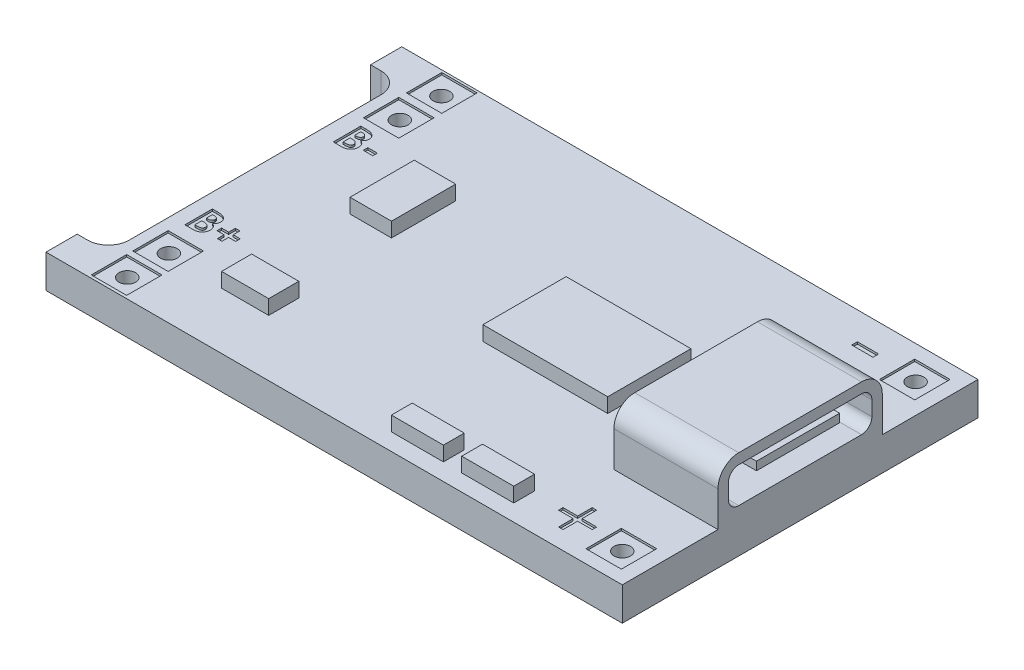
from build123d import *

# Parameters (mm, degrees)
SKETCH1_R           = 0.4
BOSS_EXTRUDE1_DEPTH = 1.6
SKETCH2_W           = 1.7
SKETCH2_H           = 1.7
CUT_EXTRUDE1_DEPTH  = 0.1
CUT_EXTRUDE2_START  = -1.6
SKETCH2_2_W         = 1.7
SKETCH2_2_H         = 1.7
CUT_EXTRUDE2_DEPTH  = 0.1
SKETCH3_W           = 1.993109399
SKETCH3_H           = 3.08736554
SKETCH3_W_2         = 2.266673434
SKETCH3_H_2         = 1.445981329
SKETCH3_W_3         = 2.5
SKETCH3_H_3         = 1
SKETCH3_W_4         = 6
SKETCH3_H_4         = 4
SKETCH3_W_5         = 5
SKETCH3_H_5         = 7.9
BOSS_EXTRUDE2_DEPTH = 0.7
SKETCH3_2_W         = 5
SKETCH3_2_H         = 7.9
BOSS_EXTRUDE3_DEPTH = 2.7
FILLET1_R           = 1
SKETCH4_W           = 4
SKETCH4_H           = 0.4
CUT_EXTRUDE3_DEPTH  = 4
SKETCH7_W           = 0.457932693
SKETCH7_H           = 0.220486111
CUT_EXTRUDE4_DEPTH  = 0.1
SKETCH6_W           = 1.017628206
SKETCH6_H           = 0.271367521
CUT_EXTRUDE5_DEPTH  = 0.1
CUT_EXTRUDE6_DEPTH  = 0.1


with BuildPart() as part:
    # Sketch1 → Boss-Extrude1 (new body)
    with BuildSketch(Plane(origin=(0, 0, 0), x_dir=(1, 0, 0), z_dir=(0, 1, 0))):
        with BuildLine():
            Line((0, 0), (27.7, 0))
            Line((27.7, 0), (27.7, 17.1))
            Line((27.7, 17.1), (0, 17.1))
            Line((0, 17.1), (0, 15.6))
            Line((0, 15.6), (0.5, 15.6))
            ThreePointArc((0.5, 15.6), (1.207106781, 15.307106781), (1.5, 14.6))
            Line((1.5, 14.6), (1.5, 2.5))
            ThreePointArc((1.5, 2.5), (1.207106781, 1.792893219), (0.5, 1.5))
            Line((0.5, 1.5), (0, 1.5))
            Line((0, 1.5), (0, 0))
        make_face()
        with Locations(Location((2.907438593, 16.1, 0), (0, 0, 270))):
            Circle(SKETCH1_R, mode=Mode.SUBTRACT)
        with Locations(Location((2.907438593, 14.1, 0), (0, 0, 270))):
            Circle(SKETCH1_R, mode=Mode.SUBTRACT)
        with Locations(Location((2.907438593, 3, 0), (0, 0, 270))):
            Circle(SKETCH1_R, mode=Mode.SUBTRACT)
        with Locations(Location((2.907438593, 1, 0), (0, 0, 270))):
            Circle(SKETCH1_R, mode=Mode.SUBTRACT)
        with Locations(Location((26.2, 15.6, 0), (0, 0, 270))):
            Circle(SKETCH1_R, mode=Mode.SUBTRACT)
        with Locations(Location((26.2, 1.5, 0), (0, 0, 270))):
            Circle(SKETCH1_R, mode=Mode.SUBTRACT)
    extrude(amount=BOSS_EXTRUDE1_DEPTH)

    # Sketch2 → Cut-Extrude1 (cut)
    with BuildSketch(Plane(origin=(0, 1.6, 0), x_dir=(1, 0, 0), z_dir=(0, 1, 0))):
        with Locations((2.885159762, 16.138735787)):
            Rectangle(SKETCH2_W, SKETCH2_H)
        with Locations((2.885159762, 14.071021036)):
            Rectangle(SKETCH2_W, SKETCH2_H)
        with Locations((2.888957816, 2.981417951)):
            Rectangle(SKETCH2_W, SKETCH2_H)
        with Locations((2.888957816, 0.988098465)):
            Rectangle(SKETCH2_W, SKETCH2_H)
        with Locations((26.182003828, 15.576133366)):
            Rectangle(SKETCH2_W, SKETCH2_H)
        with Locations((26.175693586, 1.480002018)):
            Rectangle(SKETCH2_W, SKETCH2_H)
    extrude(amount=-CUT_EXTRUDE1_DEPTH, mode=Mode.SUBTRACT)

    # Sketch2<2> → Cut-Extrude2 (cut)
    with BuildSketch(Plane(origin=(0, 1.6, 0), x_dir=(1, 0, 0), z_dir=(0, 1, 0)).offset(CUT_EXTRUDE2_START)):
        with Locations((2.885159762, 16.138735787)):
            Rectangle(SKETCH2_2_W, SKETCH2_2_H)
        with Locations((2.885159762, 14.071021036)):
            Rectangle(SKETCH2_2_W, SKETCH2_2_H)
        with Locations((2.888957816, 2.981417951)):
            Rectangle(SKETCH2_2_W, SKETCH2_2_H)
        with Locations((2.888957816, 0.988098465)):
            Rectangle(SKETCH2_2_W, SKETCH2_2_H)
        with Locations((26.182003828, 15.576133366)):
            Rectangle(SKETCH2_2_W, SKETCH2_2_H)
        with Locations((26.175693586, 1.480002018)):
            Rectangle(SKETCH2_2_W, SKETCH2_2_H)
    extrude(amount=CUT_EXTRUDE2_DEPTH, mode=Mode.SUBTRACT)

    # Sketch3 → Boss-Extrude2 (add)
    with BuildSketch(Plane(origin=(0, 1.6, 0), x_dir=(1, 0, 0), z_dir=(0, 1, 0))):
        with Locations((6.717794797, 10.435637814)):
            Rectangle(SKETCH3_W, SKETCH3_H)
        with Locations((6.854576815, 3.440214628)):
            Rectangle(SKETCH3_W_2, SKETCH3_H_2)
        with Locations((17.034488534, 1.318370706)):
            Rectangle(SKETCH3_W_3, SKETCH3_H_3)
        with Locations((20.435077133, 1.298830418)):
            Rectangle(SKETCH3_W_3, SKETCH3_H_3)
        with Locations((17.220133962, 8.781603915)):
            Rectangle(SKETCH3_W_4, SKETCH3_H_4)
        with Locations((25.2, 8.55)):
            Rectangle(SKETCH3_W_5, SKETCH3_H_5)
    extrude(amount=BOSS_EXTRUDE2_DEPTH)

    # Sketch3<2> → Boss-Extrude3 (add)
    with BuildSketch(Plane(origin=(0, 1.6, 0), x_dir=(1, 0, 0), z_dir=(0, 1, 0))):
        with Locations((25.2, 8.55)):
            Rectangle(SKETCH3_2_W, SKETCH3_2_H)
    extrude(amount=BOSS_EXTRUDE3_DEPTH)

    # Fillet1
    fillet1_edges = [part.edges().sort_by_distance(p)[0] for p in [
        (25.2, 4.3, -4.6),
        (25.2, 4.3, -12.5),
    ]]
    fillet(fillet1_edges, radius=FILLET1_R)

    # Sketch4 → Cut-Extrude3 (cut)
    with BuildSketch(Plane(origin=(27.7, 0, 0), x_dir=(0, 0, -1), z_dir=(1, 0, 0))):
        with BuildLine():
            Line((5.1, 3.3), (5.1, 2.6))
            ThreePointArc((5.1, 2.6), (5.246446609, 2.246446609), (5.6, 2.1))
            Line((5.6, 2.1), (11.5, 2.1))
            ThreePointArc((11.5, 2.1), (11.853553391, 2.246446609), (12, 2.6))
            Line((12, 2.6), (12, 3.3))
            ThreePointArc((12, 3.3), (11.853553391, 3.653553391), (11.5, 3.8))
            Line((11.5, 3.8), (5.6, 3.8))
            ThreePointArc((5.6, 3.8), (5.246446609, 3.653553391), (5.1, 3.3))
        make_face()
        with Locations((8.451076766, 3.321053565)):
            Rectangle(SKETCH4_W, SKETCH4_H, mode=Mode.SUBTRACT)
    extrude(amount=-CUT_EXTRUDE3_DEPTH, mode=Mode.SUBTRACT)

    # Sketch7 → Cut-Extrude4 (cut)
    # profile 1 of 4: a face of its own
    with BuildSketch(Plane(origin=(0, 1.6, 0), x_dir=(1, 0, 0), z_dir=(0, 1, 0))):
        with BuildLine():
            Line((2.200310142, 4.475849905), (2.200310142, 5.798766571))
            Line((2.200310142, 5.798766571), (2.412316018, 5.798766571))
            add(Edge.make_bspline(
                [(2.412316018, 5.798766571), (2.427157755, 5.798768265), (2.455876234, 5.798771543), (2.497309505, 5.797316542), (2.535735365, 5.795434336), (2.571031528, 5.793328585), (2.60325807, 5.789699956), (2.632365985, 5.785875776), (2.658413432, 5.781264052), (2.674517153, 5.777127192), (2.682093495, 5.775180918)],
                knots=[0, 0, 0, 0, 1.311965854, 2.538629056, 3.664479157, 4.713267157, 5.663616078, 6.530575999, 7.308677837, 8, 8, 8, 8], degree=3))
            add(Edge.make_bspline(
                [(2.682093495, 5.775180918), (2.692042002, 5.772435662), (2.711564165, 5.767048591), (2.739526134, 5.756169166), (2.766051961, 5.744075914), (2.79110926, 5.730279776), (2.81454417, 5.714614193), (2.836267628, 5.696954838), (2.856748158, 5.678010558), (2.875258541, 5.65725338), (2.891988877, 5.635319576), (2.90652454, 5.612214894), (2.919154168, 5.588292619), (2.929261178, 5.563251706), (2.936876621, 5.537207475), (2.942446524, 5.510271137), (2.946056575, 5.482357462), (2.946397677, 5.463366876), (2.946570825, 5.453727008)],
                knots=[0, 0, 0, 0, 1.099996261, 2.158545794, 3.195537121, 4.207578794, 5.205712374, 6.197378256, 7.190519799, 8.17788031, 9.159561366, 10.129234751, 11.085776129, 12.040971148, 13.00380137, 13.975669004, 14.972423361, 16, 16, 16, 16], degree=3))
            add(Edge.make_bspline(
                [(2.946570825, 5.453727008), (2.946118095, 5.441342309), (2.94522695, 5.416964549), (2.939534256, 5.381158032), (2.928859569, 5.347315726), (2.914892001, 5.314813931), (2.895900475, 5.283773879), (2.871784909, 5.254210328), (2.842935898, 5.225212973), (2.820807114, 5.207831015), (2.809297021, 5.198789942)],
                knots=[0, 0, 0, 0, 0.986156485, 1.941127874, 2.875419072, 3.804401753, 4.751181392, 5.761612777, 6.835722519, 8, 8, 8, 8], degree=3))
            add(Edge.make_bspline(
                [(2.809297021, 5.198789942), (2.818624248, 5.194028473), (2.83691236, 5.184692551), (2.862876106, 5.169347081), (2.886915701, 5.153025228), (2.909138931, 5.136055393), (2.929079638, 5.117718201), (2.947561207, 5.099070266), (2.963671855, 5.079043139), (2.978078481, 5.058350625), (2.990600486, 5.036693094), (3.001505772, 5.01410712), (3.010717076, 4.990515546), (3.018517446, 4.966038432), (3.024334965, 4.940591589), (3.02812811, 4.914165916), (3.03103238, 4.886851539), (3.031258304, 4.868245667), (3.031373176, 4.858785518)],
                knots=[0, 0, 0, 0, 1.164658916, 2.283573913, 3.35186032, 4.395461096, 5.390182219, 6.362969632, 7.312859996, 8.245001507, 9.165155236, 10.092416118, 11.032087915, 11.979892451, 12.947605196, 13.931445124, 14.948243989, 16, 16, 16, 16], degree=3))
            add(Edge.make_bspline(
                [(3.031373176, 4.858785518), (3.030627737, 4.840717175), (3.029156617, 4.805059371), (3.018400503, 4.752705525), (2.999752818, 4.703069331), (2.974712824, 4.656348064), (2.943858733, 4.613894228), (2.908385376, 4.576705036), (2.868649889, 4.54522521), (2.8319891, 4.523978771), (2.800280404, 4.509720422), (2.774016684, 4.500905013), (2.745810005, 4.49273843), (2.715143689, 4.487003687), (2.682573674, 4.48175462), (2.647782401, 4.478513737), (2.610834893, 4.476317471), (2.585457748, 4.476008911), (2.572380454, 4.475849905)],
                knots=[0, 0, 0, 0, 1.284142165, 2.534249414, 3.780121997, 5.041676246, 6.291546858, 7.49970053, 8.684500223, 9.883330709, 10.50184324, 11.153274765, 11.851151195, 12.587658647, 13.369265475, 14.195992086, 15.070362669, 16, 16, 16, 16], degree=3))
            Line((2.572380454, 4.475849905), (2.200310142, 4.475849905))
        make_face()
        with BuildLine():
            Line((2.437756723, 5.56131999), (2.437756723, 5.272991999))
            Line((2.437756723, 5.272991999), (2.500828471, 5.272991999))
            add(Edge.make_bspline(
                [(2.500828471, 5.272991999), (2.509400488, 5.27306675), (2.525948249, 5.273211053), (2.549849733, 5.275069622), (2.572074254, 5.278240456), (2.592537519, 5.282664568), (2.611430149, 5.288282544), (2.628631454, 5.29504218), (2.644065802, 5.30328967), (2.661996945, 5.315574671), (2.680951456, 5.3336526), (2.697636899, 5.359769913), (2.707464513, 5.389804724), (2.708559044, 5.410987599), (2.709124244, 5.421926127)],
                knots=[0, 0, 0, 0, 1.065314748, 2.056525647, 2.977365736, 3.853934255, 4.656397591, 5.425096493, 6.14721249, 6.826394842, 8.123232004, 9.372140726, 10.643011755, 12, 12, 12, 12], degree=3))
            add(Edge.make_bspline(
                [(2.709124244, 5.421926127), (2.708671981, 5.432171875), (2.707797548, 5.451981619), (2.697902403, 5.479796263), (2.682533288, 5.50444573), (2.664387888, 5.521316274), (2.647300467, 5.532838358), (2.632669169, 5.54042516), (2.61661022, 5.547216788), (2.598812738, 5.552409832), (2.579378354, 5.556306509), (2.558401473, 5.559168152), (2.535845903, 5.561115908), (2.520266723, 5.561250504), (2.512223787, 5.56131999)],
                knots=[0, 0, 0, 0, 1.347982417, 2.606269829, 3.849316587, 5.153353503, 5.842674298, 6.568177932, 7.326619318, 8.142485038, 9.012069166, 9.942760135, 10.937925643, 12, 12, 12, 12], degree=3))
            Line((2.512223787, 5.56131999), (2.437756723, 5.56131999))
        make_face(mode=Mode.SUBTRACT)
        with BuildLine():
            Line((2.437756723, 5.052505888), (2.437756723, 4.713296486))
            Line((2.437756723, 4.713296486), (2.506128618, 4.713296486))
            add(Edge.make_bspline(
                [(2.506128618, 4.713296486), (2.519645829, 4.713373709), (2.545634353, 4.713522181), (2.582862868, 4.715316069), (2.616712895, 4.718549237), (2.647094745, 4.722585587), (2.674054953, 4.728054209), (2.697502387, 4.735006862), (2.717758598, 4.742655991), (2.734702129, 4.752103573), (2.748544023, 4.763098216), (2.761034881, 4.774335005), (2.771219149, 4.787297703), (2.779277131, 4.801429858), (2.786251301, 4.816380415), (2.790457627, 4.832733189), (2.793660177, 4.850003524), (2.793836422, 4.86194904), (2.793926595, 4.868060775)],
                knots=[0, 0, 0, 0, 1.753078804, 3.370512758, 4.83203934, 6.162291463, 7.344201807, 8.395507345, 9.331626367, 10.147333109, 10.898971645, 11.62040215, 12.321813352, 13.025280112, 13.727906689, 14.453419512, 15.208716525, 16, 16, 16, 16], degree=3))
            add(Edge.make_bspline(
                [(2.793926595, 4.868060775), (2.793727737, 4.87504964), (2.793340417, 4.888662069), (2.790177169, 4.908558087), (2.784428512, 4.92713234), (2.777187799, 4.944859796), (2.767111962, 4.961105752), (2.755137175, 4.976432417), (2.740668574, 4.990320783), (2.724397788, 5.003610872), (2.705419528, 5.015247065), (2.683724889, 5.025343523), (2.659196013, 5.033775713), (2.631756921, 5.040489429), (2.601527903, 5.046187266), (2.56828832, 5.049589504), (2.532315004, 5.052119898), (2.50737052, 5.052374301), (2.494468295, 5.052505888)],
                knots=[0, 0, 0, 0, 0.845221588, 1.646264278, 2.427170338, 3.19324141, 3.95557735, 4.731569926, 5.540061037, 6.376114724, 7.268642756, 8.224665384, 9.265483498, 10.400594375, 11.639216012, 12.983232105, 14.439614077, 16, 16, 16, 16], degree=3))
            Line((2.494468295, 5.052505888), (2.437756723, 5.052505888))
        make_face(mode=Mode.SUBTRACT)
    # profile 2 of 4: a face of its own
    with BuildSketch(Plane(origin=(0, 1.6, 0), x_dir=(1, 0, 0), z_dir=(0, 1, 0))):
        Polygon((3.557147748, 5.222110588), (3.557147748, 5.54435952), (3.77763386, 5.54435952), (3.77763386, 5.222110588), (4.116843261, 5.222110588), (4.116843261, 5.001624477), (3.77763386, 5.001624477), (3.77763386, 4.679375546), (3.557147748, 4.679375546), (3.557147748, 5.001624477), (3.217938347, 5.001624477), (3.217938347, 5.222110588), align=None)
    # profile 3 of 4: a face of its own
    with BuildSketch(Plane(origin=(0, 1.6, 0), x_dir=(1, 0, 0), z_dir=(0, 1, 0))):
        with BuildLine():
            Line((2.317551871, 11.490813378), (2.317551871, 12.813730045))
            Line((2.317551871, 12.813730045), (2.529557747, 12.813730045))
            add(Edge.make_bspline(
                [(2.529557747, 12.813730045), (2.544399484, 12.813731739), (2.573117964, 12.813735016), (2.614551235, 12.812280016), (2.652977095, 12.81039781), (2.688273257, 12.808292059), (2.720499799, 12.804663429), (2.749607715, 12.80083925), (2.775655161, 12.796227526), (2.791758882, 12.792090666), (2.799335224, 12.790144391)],
                knots=[0, 0, 0, 0, 1.311965854, 2.538629056, 3.664479157, 4.713267157, 5.663616078, 6.530575999, 7.308677837, 8, 8, 8, 8], degree=3))
            add(Edge.make_bspline(
                [(2.799335224, 12.790144391), (2.809283731, 12.787399136), (2.828805895, 12.782012064), (2.856767863, 12.77113264), (2.883293691, 12.759039388), (2.90835099, 12.745243249), (2.931785899, 12.729577666), (2.953509358, 12.711918312), (2.973989887, 12.692974031), (2.99250027, 12.672216853), (3.009230606, 12.65028305), (3.023766269, 12.627178368), (3.036395897, 12.603256093), (3.046502908, 12.57821518), (3.05411835, 12.552170948), (3.059688253, 12.525234611), (3.063298304, 12.497320935), (3.063639407, 12.478330349), (3.063812555, 12.468690482)],
                knots=[0, 0, 0, 0, 1.099996261, 2.158545794, 3.195537121, 4.207578794, 5.205712374, 6.197378256, 7.190519799, 8.17788031, 9.159561366, 10.129234751, 11.085776129, 12.040971148, 13.00380137, 13.975669004, 14.972423361, 16, 16, 16, 16], degree=3))
            add(Edge.make_bspline(
                [(3.063812555, 12.468690482), (3.063359824, 12.456305782), (3.062468679, 12.431928023), (3.056775986, 12.396121505), (3.046101299, 12.362279199), (3.03213373, 12.329777404), (3.013142204, 12.298737352), (2.989026639, 12.269173802), (2.960177627, 12.240176447), (2.938048843, 12.222794489), (2.92653875, 12.213753416)],
                knots=[0, 0, 0, 0, 0.986156485, 1.941127874, 2.875419072, 3.804401753, 4.751181392, 5.761612777, 6.835722519, 8, 8, 8, 8], degree=3))
            add(Edge.make_bspline(
                [(2.92653875, 12.213753416), (2.935865977, 12.208991947), (2.954154089, 12.199656024), (2.980117836, 12.184310555), (3.00415743, 12.167988701), (3.02638066, 12.151018867), (3.046321367, 12.132681675), (3.064802937, 12.11403374), (3.080913584, 12.094006613), (3.09532021, 12.073314099), (3.107842216, 12.051656568), (3.118747501, 12.029070594), (3.127958805, 12.005479019), (3.135759176, 11.981001905), (3.141576694, 11.955555062), (3.145369839, 11.92912939), (3.148274109, 11.901815013), (3.148500034, 11.883209141), (3.148614905, 11.873748992)],
                knots=[0, 0, 0, 0, 1.164658916, 2.283573913, 3.35186032, 4.395461096, 5.390182219, 6.362969632, 7.312859996, 8.245001507, 9.165155236, 10.092416118, 11.032087915, 11.979892451, 12.947605196, 13.931445124, 14.948243989, 16, 16, 16, 16], degree=3))
            add(Edge.make_bspline(
                [(3.148614905, 11.873748992), (3.147869466, 11.855680648), (3.146398346, 11.820022844), (3.135642232, 11.767668999), (3.116994548, 11.718032805), (3.091954553, 11.671311537), (3.061100462, 11.628857701), (3.025627106, 11.591668509), (2.985891619, 11.560188684), (2.949230829, 11.538942244), (2.917522133, 11.524683896), (2.891258413, 11.515868486), (2.863051734, 11.507701904), (2.832385418, 11.501967161), (2.799815403, 11.496718094), (2.76502413, 11.493477211), (2.728076623, 11.491280944), (2.702699477, 11.490972385), (2.689622183, 11.490813378)],
                knots=[0, 0, 0, 0, 1.284142165, 2.534249414, 3.780121997, 5.041676246, 6.291546858, 7.49970053, 8.684500223, 9.883330709, 10.50184324, 11.153274765, 11.851151195, 12.587658647, 13.369265475, 14.195992086, 15.070362669, 16, 16, 16, 16], degree=3))
            Line((2.689622183, 11.490813378), (2.317551871, 11.490813378))
        make_face()
        with BuildLine():
            Line((2.554998452, 12.576283464), (2.554998452, 12.287955472))
            Line((2.554998452, 12.287955472), (2.6180702, 12.287955472))
            add(Edge.make_bspline(
                [(2.6180702, 12.287955472), (2.626642218, 12.288030223), (2.643189978, 12.288174526), (2.667091463, 12.290033095), (2.689315984, 12.29320393), (2.709779248, 12.297628041), (2.728671878, 12.303246018), (2.745873183, 12.310005653), (2.761307531, 12.318253144), (2.779238674, 12.330538144), (2.798193185, 12.348616073), (2.814878628, 12.374733387), (2.824706242, 12.404768198), (2.825800774, 12.425951072), (2.826365974, 12.4368896)],
                knots=[0, 0, 0, 0, 1.065314748, 2.056525647, 2.977365736, 3.853934255, 4.656397591, 5.425096493, 6.14721249, 6.826394842, 8.123232004, 9.372140726, 10.643011755, 12, 12, 12, 12], degree=3))
            add(Edge.make_bspline(
                [(2.826365974, 12.4368896), (2.82591371, 12.447135349), (2.825039277, 12.466945092), (2.815144133, 12.494759736), (2.799775018, 12.519409203), (2.781629617, 12.536279748), (2.764542196, 12.547801832), (2.749910898, 12.555388634), (2.73385195, 12.562180261), (2.716054467, 12.567373305), (2.696620084, 12.571269983), (2.675643203, 12.574131626), (2.653087632, 12.576079382), (2.637508452, 12.576213977), (2.629465516, 12.576283464)],
                knots=[0, 0, 0, 0, 1.347982417, 2.606269829, 3.849316587, 5.153353503, 5.842674298, 6.568177932, 7.326619318, 8.142485038, 9.012069166, 9.942760135, 10.937925643, 12, 12, 12, 12], degree=3))
            Line((2.629465516, 12.576283464), (2.554998452, 12.576283464))
        make_face(mode=Mode.SUBTRACT)
        with BuildLine():
            Line((2.554998452, 12.067469361), (2.554998452, 11.728259959))
            Line((2.554998452, 11.728259959), (2.623370347, 11.728259959))
            add(Edge.make_bspline(
                [(2.623370347, 11.728259959), (2.636887558, 11.728337183), (2.662876082, 11.728485654), (2.700104597, 11.730279543), (2.733954625, 11.733512711), (2.764336474, 11.73754906), (2.791296682, 11.743017683), (2.814744116, 11.749970335), (2.835000327, 11.757619464), (2.851943858, 11.767067047), (2.865785752, 11.77806169), (2.87827661, 11.789298479), (2.888460878, 11.802261177), (2.89651886, 11.816393331), (2.90349303, 11.831343888), (2.907699357, 11.847696663), (2.910901906, 11.864966997), (2.911078151, 11.876912514), (2.911168324, 11.883024249)],
                knots=[0, 0, 0, 0, 1.753078804, 3.370512758, 4.83203934, 6.162291463, 7.344201807, 8.395507345, 9.331626367, 10.147333109, 10.898971645, 11.62040215, 12.321813352, 13.025280112, 13.727906689, 14.453419512, 15.208716525, 16, 16, 16, 16], degree=3))
            add(Edge.make_bspline(
                [(2.911168324, 11.883024249), (2.910969467, 11.890013114), (2.910582147, 11.903625543), (2.907418898, 11.923521561), (2.901670242, 11.942095813), (2.894429529, 11.95982327), (2.884353692, 11.976069225), (2.872378904, 11.99139589), (2.857910303, 12.005284257), (2.841639518, 12.018574346), (2.822661257, 12.030210538), (2.800966618, 12.040306997), (2.776437743, 12.048739187), (2.74899865, 12.055452902), (2.718769632, 12.061150739), (2.685530049, 12.064552977), (2.649556733, 12.067083371), (2.62461225, 12.067337774), (2.611710024, 12.067469361)],
                knots=[0, 0, 0, 0, 0.845221588, 1.646264278, 2.427170338, 3.19324141, 3.95557735, 4.731569926, 5.540061037, 6.376114724, 7.268642756, 8.224665384, 9.265483498, 10.400594375, 11.639216012, 12.983232105, 14.439614077, 16, 16, 16, 16], degree=3))
            Line((2.611710024, 12.067469361), (2.554998452, 12.067469361))
        make_face(mode=Mode.SUBTRACT)
    # profile 4 of 4: a face of its own
    with BuildSketch(Plane(origin=(0, 1.6, 0), x_dir=(1, 0, 0), z_dir=(0, 1, 0))):
        with Locations((3.615027833, 11.974186776)):
            Rectangle(SKETCH7_W, SKETCH7_H)
    extrude(amount=-CUT_EXTRUDE4_DEPTH, mode=Mode.SUBTRACT)

    # Sketch6 → Cut-Extrude5 (cut)
    with BuildSketch(Plane(origin=(0, 1.6, 0), x_dir=(1, 0, 0), z_dir=(0, 1, 0))):
        with Locations((23.742213831, 15.6348877)):
            Rectangle(SKETCH6_W, SKETCH6_H)
    extrude(amount=-CUT_EXTRUDE5_DEPTH, mode=Mode.SUBTRACT)

    # Sketch5 → Cut-Extrude6 (cut)
    with BuildSketch(Plane(origin=(0, 1.6, 0), x_dir=(1, 0, 0), z_dir=(0, 1, 0))):
        Polygon((23.762949699, 1.791382933), (23.762949699, 2.493546395), (23.976651622, 2.493546395), (23.976651622, 1.791382933), (24.678815084, 1.791382933), (24.678815084, 1.57768101), (23.976651622, 1.57768101), (23.976651622, 0.875517548), (23.762949699, 0.875517548), (23.762949699, 1.57768101), (23.060786238, 1.57768101), (23.060786238, 1.791382933), align=None)
    extrude(amount=-CUT_EXTRUDE6_DEPTH, mode=Mode.SUBTRACT)


solid = part.part
